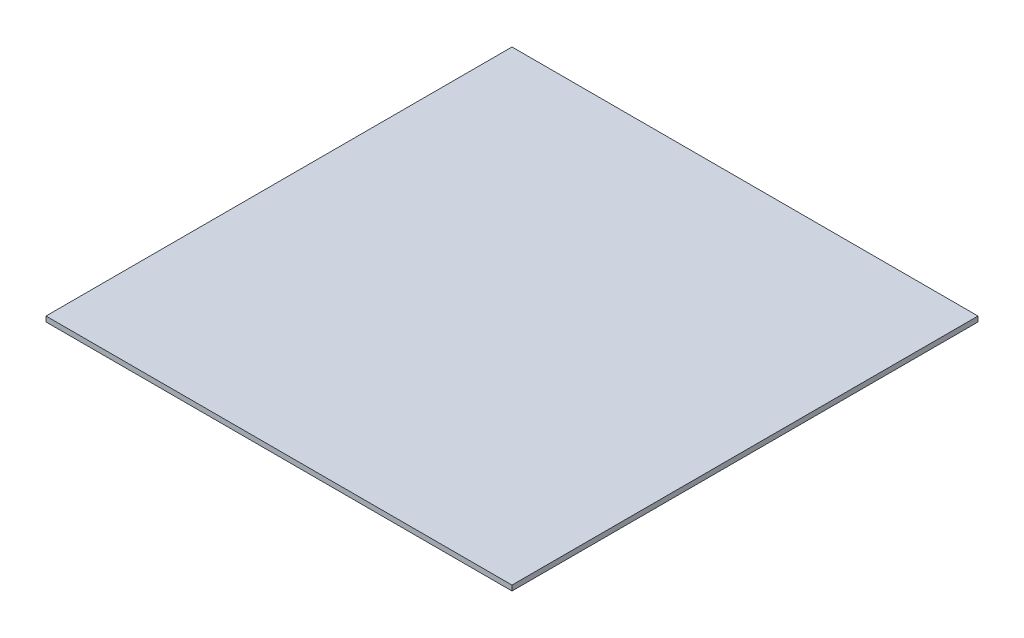
from build123d import *

# Parameters (mm, degrees)
SKETCH1_W           = 900
SKETCH1_H           = 900
BOSS_EXTRUDE1_DEPTH = 10


with BuildPart() as part:
    # Sketch1 → Boss-Extrude1 (new body)
    with BuildSketch(Plane(origin=(0, 0, 0), x_dir=(1, 0, 0), z_dir=(0, 1, 0))):
        Rectangle(SKETCH1_W, SKETCH1_H)
    extrude(amount=BOSS_EXTRUDE1_DEPTH)


solid = part.part
